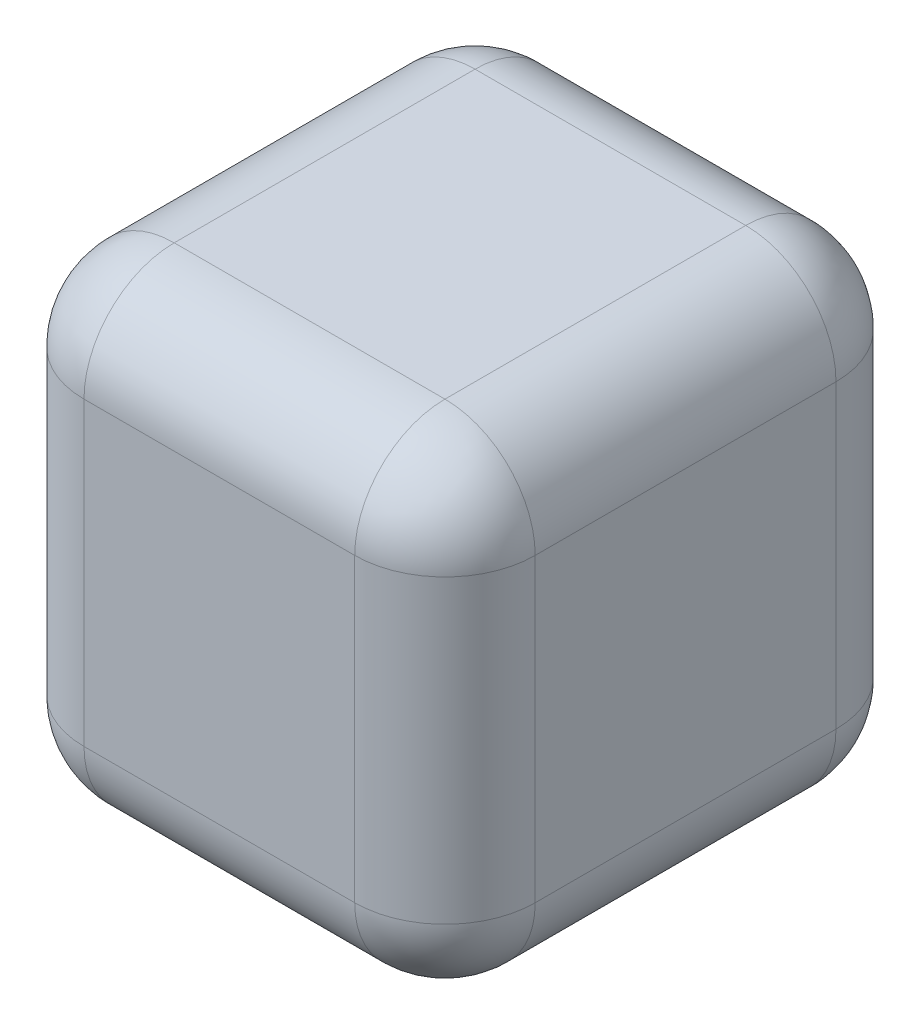
from build123d import *

# Parameters (mm, degrees)
SKETCH1_W           = 32
SKETCH1_H           = 32
BOSS_EXTRUDE1_DEPTH = 30
FILLET1_R           = 6
SKETCH2_R           = 1.5
BOSS_EXTRUDE2_DEPTH = 2.8


with BuildPart() as part:
    # Sketch1 → Boss-Extrude1 (new body)
    with BuildSketch(Plane(origin=(24, 0, 0), x_dir=(0, 0, -1), z_dir=(1, 0, 0))):
        Rectangle(SKETCH1_W, SKETCH1_H)
    extrude(amount=BOSS_EXTRUDE1_DEPTH)

    # Fillet1
    fillet1_edges = [part.edges().sort_by_distance(p)[0] for p in [
        (54, 0, -16),
        (54, 16, 0),
        (54, 0, 16),
        (24, 16, 0),
        (24, 0, -16),
        (24, -16, 0),
        (24, 0, 16),
        (39, 16, 16),
        (39, 16, -16),
        (39, -16, -16),
        (39, -16, 16),
        (54, -16, 0),
    ]]
    fillet(fillet1_edges, radius=FILLET1_R)

    # Sketch2 → Boss-Extrude2 (add)
    with BuildSketch(Plane(origin=(21.2, 0, 0), x_dir=(0, 0, -1), z_dir=(1, 0, 0))):
        with Locations((-4, -4)):
            Circle(SKETCH2_R)
        with Locations((4, -4)):
            Circle(SKETCH2_R)
        with Locations((-4, 4)):
            Circle(SKETCH2_R)
        with Locations((4, 4)):
            Circle(SKETCH2_R)
    extrude(amount=BOSS_EXTRUDE2_DEPTH)


solid = part.part
